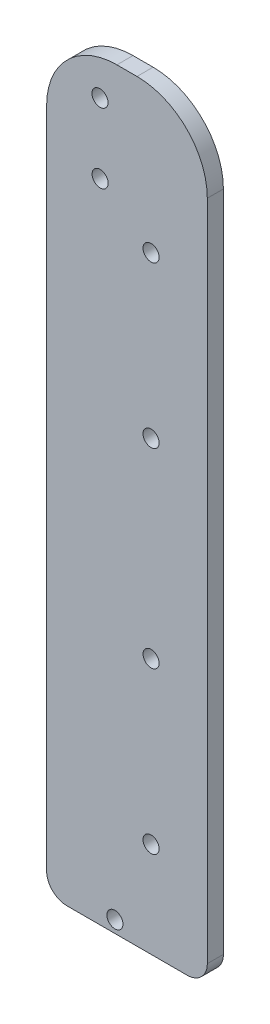
from build123d import *

# Parameters (mm, degrees)
SKETCH1_R           = 2.032
BOSS_EXTRUDE2_DEPTH = 4.064


with BuildPart() as part:
    # Sketch1 → Boss-Extrude2 (new body)
    with BuildSketch(Plane.XY):
        with BuildLine():
            Line((40.64, 5.08), (40.64, 172.72))
            ThreePointArc((40.64, 172.72), (35.432358569, 185.292358569), (22.86, 190.5))
            Line((22.86, 190.5), (17.78, 190.5))
            ThreePointArc((17.78, 190.5), (5.207641431, 185.292358569), (0, 172.72))
            Line((0, 172.72), (0, 5.08))
            ThreePointArc((0, 5.08), (1.487897552, 1.487897552), (5.08, 0))
            Line((5.08, 0), (26.416, 0))
            Line((26.416, 0), (35.56, 0))
            ThreePointArc((35.56, 0), (39.152102448, 1.487897552), (40.64, 5.08))
        make_face()
        with Locations((26.416, 24.13)):
            Circle(SKETCH1_R, mode=Mode.SUBTRACT)
        with Locations((26.416, 64.77)):
            Circle(SKETCH1_R, mode=Mode.SUBTRACT)
        with Locations((26.416, 113.03)):
            Circle(SKETCH1_R, mode=Mode.SUBTRACT)
        with Locations((26.416, 153.67)):
            Circle(SKETCH1_R, mode=Mode.SUBTRACT)
        with Locations((17.272, 3.048)):
            Circle(SKETCH1_R, mode=Mode.SUBTRACT)
        with Locations((13.531045562, 163.449)):
            Circle(SKETCH1_R, mode=Mode.SUBTRACT)
        with Locations((13.492529792, 181.102)):
            Circle(SKETCH1_R, mode=Mode.SUBTRACT)
    extrude(amount=BOSS_EXTRUDE2_DEPTH)


solid = part.part
